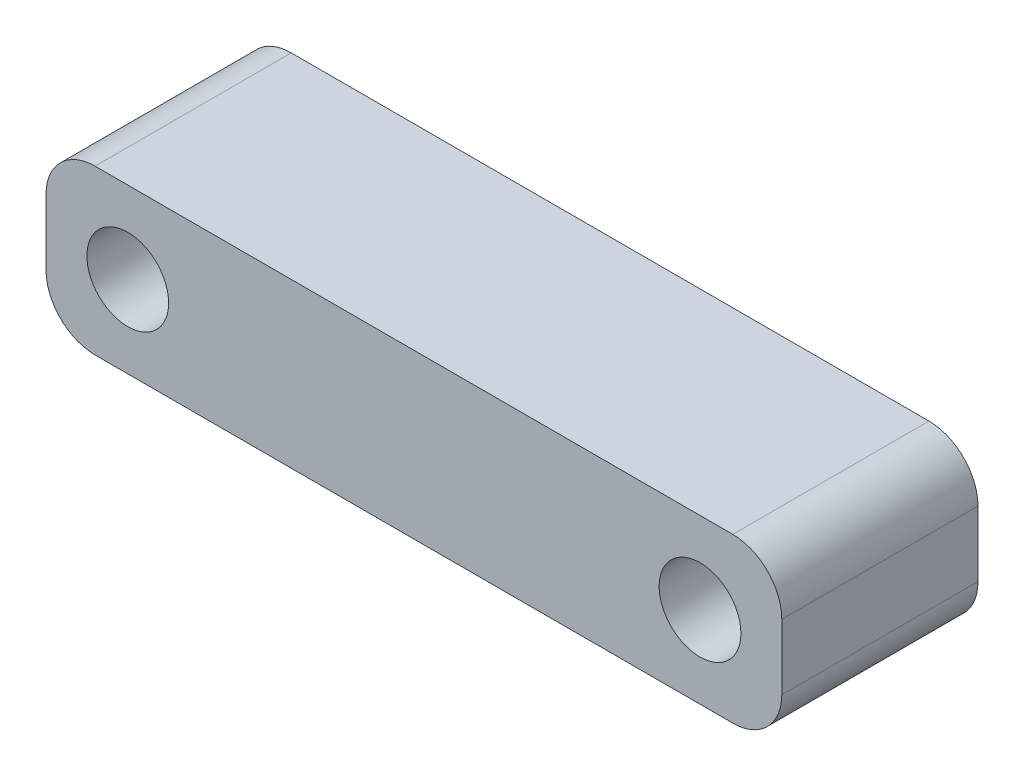
from build123d import *

# Parameters (mm, degrees)
SKETCH1_R           = 2.5
BOSS_EXTRUDE1_DEPTH = 12


with BuildPart() as part:
    # Sketch1 → Boss-Extrude1 (new body)
    with BuildSketch(Plane.XY):
        with BuildLine():
            Line((-2, 5), (37, 5))
            ThreePointArc((37, 5), (39.121320344, 4.121320344), (40, 2))
            Line((40, 2), (40, -2))
            ThreePointArc((40, -2), (39.121320344, -4.121320344), (37, -5))
            Line((37, -5), (-2, -5))
            ThreePointArc((-2, -5), (-4.121320344, -4.121320344), (-5, -2))
            Line((-5, -2), (-5, 2))
            ThreePointArc((-5, 2), (-4.121320344, 4.121320344), (-2, 5))
        make_face()
        Circle(SKETCH1_R, mode=Mode.SUBTRACT)
        with Locations((35, 0)):
            Circle(SKETCH1_R, mode=Mode.SUBTRACT)
    extrude(amount=BOSS_EXTRUDE1_DEPTH)


solid = part.part
